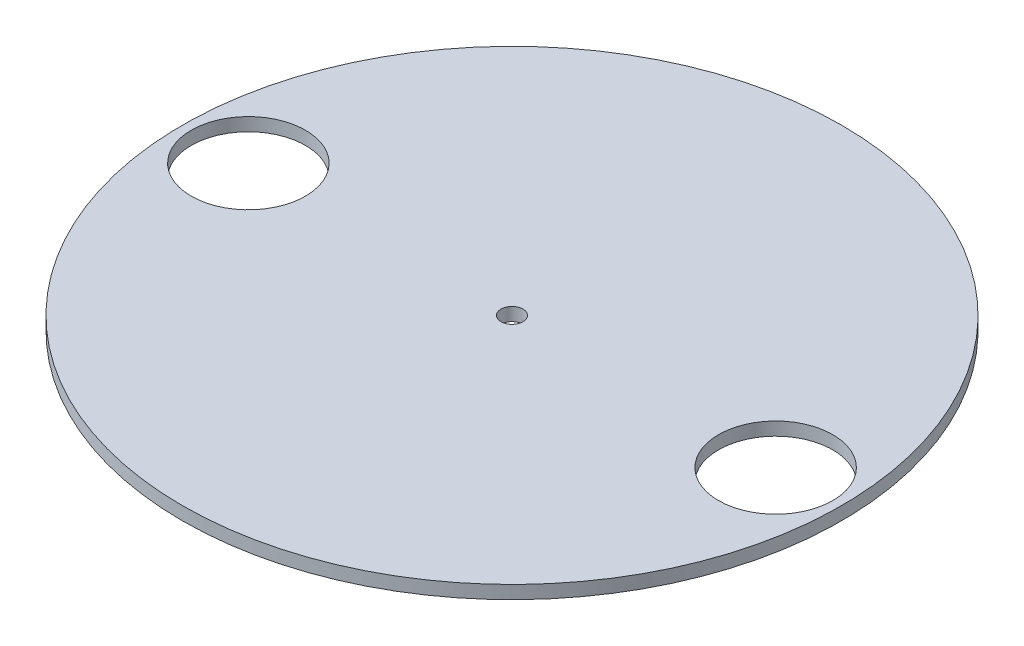
from build123d import *

# Parameters (mm, degrees)
SKETCH1_R           = 75
SKETCH1_R_2         = 13
BOSS_EXTRUDE1_DEPTH = 3
SKETCH1_4_R         = 75
SKETCH1_4_R_2       = 13
BOSS_EXTRUDE2_DEPTH = 3


with BuildPart() as part:
    # Sketch1 → Boss-Extrude1 (new body)
    with BuildSketch(Plane(origin=(0, 0, 0), x_dir=(1, 0, 0), z_dir=(0, 1, 0))):
        Circle(SKETCH1_R)
        with Locations((-60, 0)):
            Circle(SKETCH1_R_2, mode=Mode.SUBTRACT)
        with BuildLine():
            ThreePointArc((-2.5, 0), (0, 2.5), (2.5, 0))
            ThreePointArc((2.5, 0), (0, -2.5), (-2.5, 0))
        make_face(mode=Mode.SUBTRACT)
        with BuildLine():
            ThreePointArc((73, 0), (60, -13), (47, 0))
            ThreePointArc((47, 0), (60, 13), (73, 0))
        make_face(mode=Mode.SUBTRACT)
    extrude(amount=BOSS_EXTRUDE1_DEPTH)

    # Sketch1<4> → Boss-Extrude2 (add)
    with BuildSketch(Plane(origin=(0, 0, 0), x_dir=(1, 0, 0), z_dir=(0, 1, 0))):
        Circle(SKETCH1_4_R)
        with Locations((-60, 0)):
            Circle(SKETCH1_4_R_2, mode=Mode.SUBTRACT)
        with BuildLine():
            ThreePointArc((-2.5, 0), (0, 2.5), (2.5, 0))
            ThreePointArc((2.5, 0), (0, -2.5), (-2.5, 0))
        make_face(mode=Mode.SUBTRACT)
        with BuildLine():
            ThreePointArc((73, 0), (60, -13), (47, 0))
            ThreePointArc((47, 0), (60, 13), (73, 0))
        make_face(mode=Mode.SUBTRACT)
    extrude(amount=BOSS_EXTRUDE2_DEPTH)


solid = part.part
